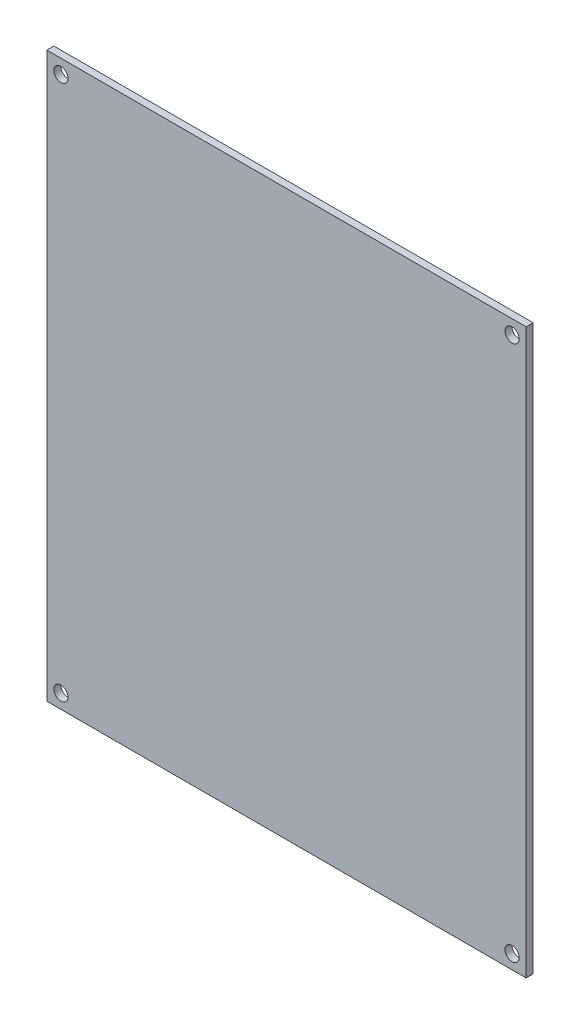
from build123d import *

# Parameters (mm, degrees)
SKETCH1_W           = 107.95
SKETCH1_H           = 127
SKETCH1_R           = 1.5875
BOSS_EXTRUDE1_DEPTH = 1.5875


with BuildPart() as part:
    # Sketch1 → Boss-Extrude1 (new body)
    with BuildSketch(Plane.XY.offset(1.5875)):
        with Locations((53.975, 63.5)):
            Rectangle(SKETCH1_W, SKETCH1_H)
        with Locations(Location((104.775, 3.175, 0), (0, 0, 180))):
            Circle(SKETCH1_R, mode=Mode.SUBTRACT)
        with Locations(Location((3.175, 123.825, 0), (0, 0, 180))):
            Circle(SKETCH1_R, mode=Mode.SUBTRACT)
        with Locations(Location((104.775, 123.825, 0), (0, 0, 180))):
            Circle(SKETCH1_R, mode=Mode.SUBTRACT)
        with Locations(Location((3.175, 3.175, 0), (0, 0, 180))):
            Circle(SKETCH1_R, mode=Mode.SUBTRACT)
    extrude(amount=-BOSS_EXTRUDE1_DEPTH)


solid = part.part
